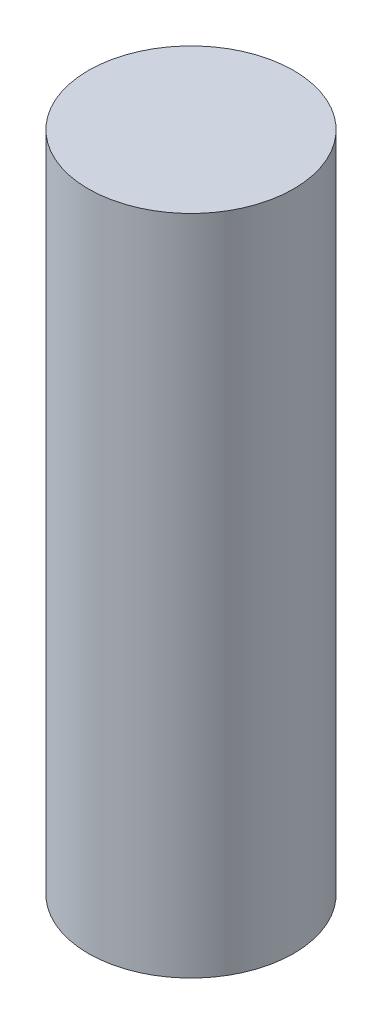
from build123d import *

# Parameters (mm, degrees)
SKETCH1_R           = 1.55
BOSS_EXTRUDE1_DEPTH = 10


with BuildPart() as part:
    # Sketch1 → Boss-Extrude1 (new body)
    with BuildSketch(Plane(origin=(0, 0, 0), x_dir=(1, 0, 0), z_dir=(0, 1, 0))):
        with Locations(Location((0, 0, 0), (0, 0, 270))):
            Circle(SKETCH1_R)
    extrude(amount=BOSS_EXTRUDE1_DEPTH)


solid = part.part
